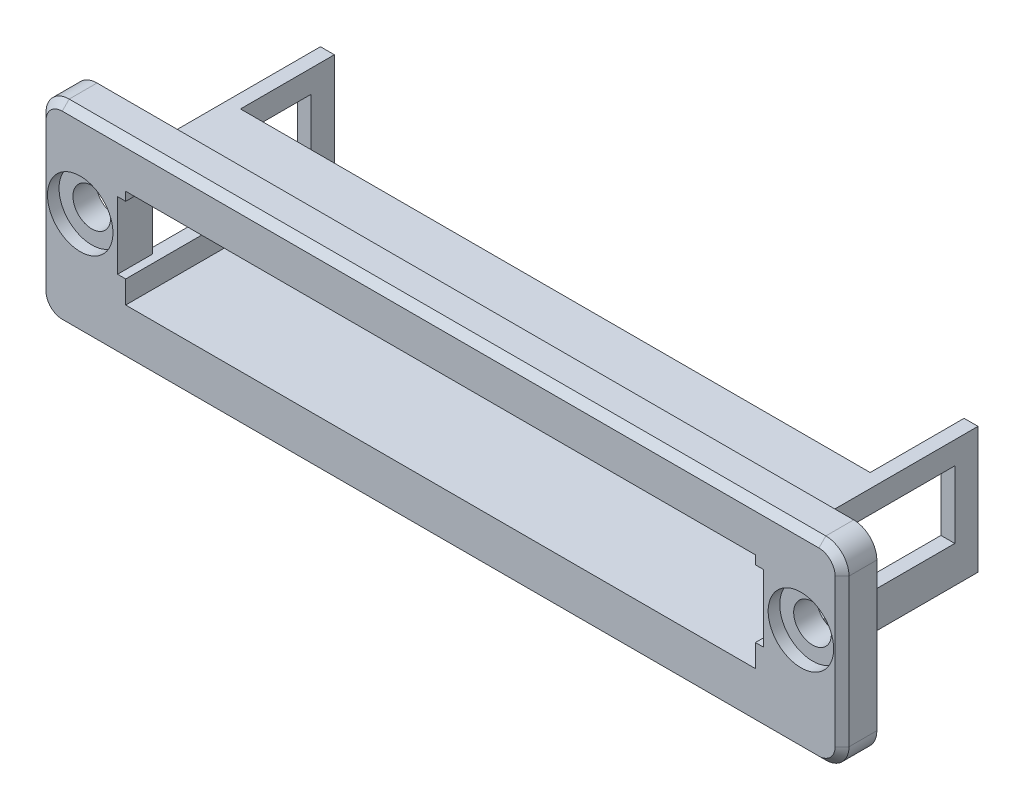
from build123d import *

# Parameters (mm, degrees)
FLANGE_DEPTH             = 3
FRONT_BEVEL_SIZE         = 0.6
OPENING_HOLES_DEPTH      = 36.974236962
OPENING_HOLES_DEPTH_BACK = 36.974236962
SK_OPENING_R             = 1.625
SK_COUNTERBORE_R         = 2.825
COUNTERBORE_DEPTH        = 1
SK_LONG_WALLS_W          = 56.72
SK_LONG_WALLS_H          = 1.2
LONG_WALLS_DEPTH         = 6.9
SK_LEGS_W                = 1.2
SK_LEGS_H                = 1.95
SK_LEGS_H_2              = 3.15
LEGS_DEPTH               = 13
SK_LEG_TIES_W            = 1.2
SK_LEG_TIES_H            = 10.9
LEG_TIES_DEPTH           = 2


with BuildPart() as part:
    # SK Flange → Flange (new body)
    with BuildSketch(Plane.XY):
        with BuildLine():
            Line((-32.635, -9.25), (32.635, -9.25))
            ThreePointArc((32.635, -9.25), (34.049213562, -8.664213562), (34.635, -7.25))
            Line((34.635, -7.25), (34.635, 5.5))
            ThreePointArc((34.635, 5.5), (34.049213562, 6.914213562), (32.635, 7.5))
            Line((32.635, 7.5), (-32.635, 7.5))
            ThreePointArc((-32.635, 7.5), (-34.049213562, 6.914213562), (-34.635, 5.5))
            Line((-34.635, 5.5), (-34.635, -7.25))
            ThreePointArc((-34.635, -7.25), (-34.049213562, -8.664213562), (-32.635, -9.25))
        make_face()
    extrude(amount=FLANGE_DEPTH)

    # Front bevel
    front_bevel_edges = [part.edges().sort_by_distance(p)[0] for p in [
        (34.049213562, -8.664213562, 3),
        (34.635, -0.875, 3),
        (34.049213562, 6.914213562, 3),
        (0, 7.5, 3),
        (-34.049213562, 6.914213562, 3),
        (-34.635, -0.875, 3),
        (-34.049213562, -8.664213562, 3),
        (0, -9.25, 3),
    ]]
    chamfer(front_bevel_edges, length=FRONT_BEVEL_SIZE)

    # SK Opening → Opening + holes (cut, two sides: drawn at the far end of the back side and taken through both)
    with BuildSketch(Plane.XY.offset(-OPENING_HOLES_DEPTH_BACK)):
        with Locations((-31.085, 0)):
            Circle(SK_OPENING_R)
        with Locations((31.085, 0)):
            Circle(SK_OPENING_R)
        Polygon((-27.16, -4.85), (27.16, -4.85), (27.16, -2.9), (27.86, -2.9), (27.86, 2.9), (27.16, 2.9), (27.16, 3.65), (-27.16, 3.65), (-27.16, 2.9), (-27.86, 2.9), (-27.86, -2.9), (-27.16, -2.9), align=None)
    extrude(amount=OPENING_HOLES_DEPTH + OPENING_HOLES_DEPTH_BACK, mode=Mode.SUBTRACT)

    # SK Counterbore → Counterbore (cut)
    with BuildSketch(Plane.XY.offset(3)):
        with Locations((-31.085, 0)):
            Circle(SK_COUNTERBORE_R)
        with Locations((31.085, 0)):
            Circle(SK_COUNTERBORE_R)
    extrude(amount=-COUNTERBORE_DEPTH, mode=Mode.SUBTRACT)

    # SK Long walls → Long walls (add)
    with BuildSketch(Plane.XY):
        with Locations((0, 4.25)):
            Rectangle(SK_LONG_WALLS_W, SK_LONG_WALLS_H)
        with Locations((0, -5.45)):
            Rectangle(SK_LONG_WALLS_W, SK_LONG_WALLS_H)
    extrude(amount=-LONG_WALLS_DEPTH)

    # SK Legs → Legs (add)
    with BuildSketch(Plane.XY):
        with Locations((-27.76, 3.875)):
            Rectangle(SK_LEGS_W, SK_LEGS_H)
        with Locations((-27.76, -4.475)):
            Rectangle(SK_LEGS_W, SK_LEGS_H_2)
        with Locations((27.76, 3.875)):
            Rectangle(SK_LEGS_W, SK_LEGS_H)
        with Locations((27.76, -4.475)):
            Rectangle(SK_LEGS_W, SK_LEGS_H_2)
    extrude(amount=-LEGS_DEPTH)

    # SK Leg ties → Leg ties (add)
    with BuildSketch(Plane.XY.offset(-13)):
        with Locations((-27.76, -0.6)):
            Rectangle(SK_LEG_TIES_W, SK_LEG_TIES_H)
        with Locations((27.76, -0.6)):
            Rectangle(SK_LEG_TIES_W, SK_LEG_TIES_H)
    extrude(amount=-LEG_TIES_DEPTH)


solid = part.part
